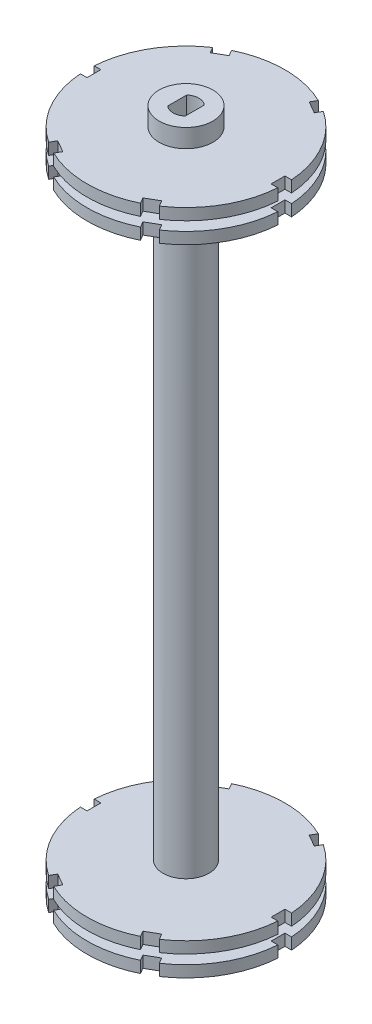
from build123d import *

# Parameters (mm, degrees)
BOSS_EXTRUDE1_DEPTH     = 6.5
SKETCH2_R               = 21.5
BOSS_EXTRUDE2_DEPTH     = 2.5
CUT_EXTRUDE1_DEPTH      = 8
SKETCH4_W               = 3
SKETCH4_H               = 3
CUT_EXTRUDE2_DEPTH      = 10
SKETCH5_R               = 5
BOSS_EXTRUDE3_DEPTH     = 140
CUT_EXTRUDE3_DEPTH      = 15
MIRROR6_COPY_1_SKETCH_R = 21.5
MIRROR6_COPY_1_DEPTH    = 2.5
MIRROR6_COPY_2_SKETCH_W = 3
MIRROR6_COPY_2_SKETCH_H = 3
MIRROR6_COPY_2_DEPTH    = 10


with BuildPart() as part:
    # Sketch1 → Boss-Extrude1 (new body)
    with BuildSketch(Plane(origin=(0, 0, 0), x_dir=(1, 0, 0), z_dir=(0, 1, 0))):
        with BuildLine():
            ThreePointArc((-1.9, -2.05669638), (-2.8, 0), (-1.9, 2.05669638))
            Line((-1.9, 2.05669638), (-1.9, 5.532856405))
            ThreePointArc((-1.9, 5.532856405), (-5.85, 0), (-1.9, -5.532856405))
            Line((-1.9, -5.532856405), (-1.9, -2.05669638))
        make_face()
        with BuildLine():
            ThreePointArc((-1.9, 2.05669638), (0, 2.8), (1.9, 2.05669638))
            Line((1.9, 2.05669638), (1.9, 5.532856405))
            ThreePointArc((1.9, 5.532856405), (0, 5.85), (-1.9, 5.532856405))
            Line((-1.9, 5.532856405), (-1.9, 2.05669638))
        make_face()
        with BuildLine():
            Line((1.9, 5.532856405), (1.9, 2.05669638))
            ThreePointArc((1.9, 2.05669638), (2.565151068, 1.122497216), (2.8, 0))
            ThreePointArc((2.8, 0), (2.565151068, -1.122497216), (1.9, -2.05669638))
            Line((1.9, -2.05669638), (1.9, -5.532856405))
            ThreePointArc((1.9, -5.532856405), (4.761171074, -3.399080758), (5.85, 0))
            ThreePointArc((5.85, 0), (4.761171074, 3.399080758), (1.9, 5.532856405))
        make_face()
        with BuildLine():
            Line((1.9, -5.532856405), (1.9, -2.05669638))
            ThreePointArc((1.9, -2.05669638), (0, -2.8), (-1.9, -2.05669638))
            Line((-1.9, -2.05669638), (-1.9, -5.532856405))
            ThreePointArc((-1.9, -5.532856405), (0, -5.85), (1.9, -5.532856405))
        make_face()
        with BuildLine():
            Line((-1.9, -2.05669638), (-1.9, 2.05669638))
            ThreePointArc((-1.9, 2.05669638), (-2.8, 0), (-1.9, -2.05669638))
        make_face()
        with BuildLine():
            ThreePointArc((2.8, 0), (2.565151068, 1.122497216), (1.9, 2.05669638))
            Line((1.9, 2.05669638), (1.9, -2.05669638))
            ThreePointArc((1.9, -2.05669638), (2.565151068, -1.122497216), (2.8, 0))
        make_face()
    boss_extrude1 = extrude(amount=BOSS_EXTRUDE1_DEPTH)

    # Sketch2 → Boss-Extrude2 (add)
    with BuildSketch(Plane(origin=(0, 6.5, 0), x_dir=(1, 0, 0), z_dir=(0, 1, 0))):
        with Locations(Location((0, 0, 0), (0, 0, 270))):
            Circle(SKETCH2_R)
    boss_extrude2 = extrude(amount=-BOSS_EXTRUDE2_DEPTH)

    # Sketch3 → Cut-Extrude1 (cut)
    with BuildSketch(Plane.XZ.offset(-4)):
        with BuildLine():
            Line((-1.9, 2.05669638), (-1.9, -2.05669638))
            ThreePointArc((-1.9, -2.05669638), (0, -2.8), (1.9, -2.05669638))
            Line((1.9, -2.05669638), (1.9, 2.05669638))
            ThreePointArc((1.9, 2.05669638), (0, 2.8), (-1.9, 2.05669638))
        make_face()
    cut_extrude1 = extrude(amount=-CUT_EXTRUDE1_DEPTH, mode=Mode.SUBTRACT)

    # Sketch4 → Cut-Extrude2 (cut)
    with BuildSketch(Plane(origin=(0, 6.5, 0), x_dir=(1, 0, 0), z_dir=(0, 1, 0))):
        Polygon((11.299038106, -16.570508076), (12.799038106, -19.168584287), (10.200961894, -20.668584287), (8.700961894, -18.070508076), align=None)
        with Locations((21.5, 0)):
            Rectangle(SKETCH4_W, SKETCH4_H)
        Polygon((-8.700961894, -18.070508076), (-10.200961894, -20.668584287), (-12.799038106, -19.168584287), (-11.299038106, -16.570508076), align=None)
        with Locations((-21.5, 0)):
            Rectangle(SKETCH4_W, SKETCH4_H)
        Polygon((-11.299038106, 16.570508076), (-12.799038106, 19.168584287), (-10.200961894, 20.668584287), (-8.700961894, 18.070508076), align=None)
        Polygon((8.700961894, 18.070508076), (10.200961894, 20.668584287), (12.799038106, 19.168584287), (11.299038106, 16.570508076), align=None)
    cut_extrude2 = extrude(amount=-CUT_EXTRUDE2_DEPTH, mode=Mode.SUBTRACT)

    # Sketch5 → Boss-Extrude3 (add)
    with BuildSketch(Plane(origin=(0, 6.5, 0), x_dir=(1, 0, 0), z_dir=(0, 1, 0))):
        with Locations(Location((0, 0, 0), (0, 0, 270))):
            Circle(SKETCH5_R)
    extrude(amount=BOSS_EXTRUDE3_DEPTH)

    # Mirror1: Boss-Extrude2 across plane
    add(boss_extrude2.mirror(Plane.ZX.offset(76.5)))

    # Mirror2: Boss-Extrude1 across plane
    add(boss_extrude1.mirror(Plane.ZX.offset(76.5)))

    # Mirror3: Boss-Extrude2, Cut-Extrude1, Cut-Extrude2 across plane
    add(boss_extrude2.mirror(Plane.ZX.offset(7.5)))
    add(cut_extrude1.mirror(Plane.ZX.offset(7.5)), mode=Mode.SUBTRACT)
    add(cut_extrude2.mirror(Plane.ZX.offset(7.5)), mode=Mode.SUBTRACT)

    # Sketch6 → Cut-Extrude3 (cut)
    with BuildSketch(Plane.XZ.offset(-11)):
        with BuildLine():
            Line((-1.9, 2.05669638), (-1.9, -2.05669638))
            ThreePointArc((-1.9, -2.05669638), (0, -2.8), (1.9, -2.05669638))
            Line((1.9, -2.05669638), (1.9, 2.05669638))
            ThreePointArc((1.9, 2.05669638), (0, 2.8), (-1.9, 2.05669638))
        make_face()
    extrude(amount=-CUT_EXTRUDE3_DEPTH, mode=Mode.SUBTRACT)

    # Mirror5: Cut-Extrude2 across plane
    add(cut_extrude2.mirror(Plane.ZX.offset(76.5)), mode=Mode.SUBTRACT)

    # Mirror6 copy 1 sketch → Mirror6 copy 1 (add)
    with BuildSketch(Plane(origin=(0, 144.5, 0), x_dir=(1, 0, 0), z_dir=(0, 1, 0))):
        with Locations(Location((0, 0, 0), (0, 0, 270))):
            Circle(MIRROR6_COPY_1_SKETCH_R)
    extrude(amount=-MIRROR6_COPY_1_DEPTH)

    # Mirror6 copy 2 sketch → Mirror6 copy 2 (cut)
    with BuildSketch(Plane(origin=(0, 144.5, 0), x_dir=(1, 0, 0), z_dir=(0, 1, 0))):
        Polygon((11.299038106, -16.570508076), (12.799038106, -19.168584287), (10.200961894, -20.668584287), (8.700961894, -18.070508076), align=None)
        with Locations((21.5, 0)):
            Rectangle(MIRROR6_COPY_2_SKETCH_W, MIRROR6_COPY_2_SKETCH_H)
        Polygon((-8.700961894, -18.070508076), (-10.200961894, -20.668584287), (-12.799038106, -19.168584287), (-11.299038106, -16.570508076), align=None)
        with Locations((-21.5, 0)):
            Rectangle(MIRROR6_COPY_2_SKETCH_W, MIRROR6_COPY_2_SKETCH_H)
        Polygon((-11.299038106, 16.570508076), (-12.799038106, 19.168584287), (-10.200961894, 20.668584287), (-8.700961894, 18.070508076), align=None)
        Polygon((8.700961894, 18.070508076), (10.200961894, 20.668584287), (12.799038106, 19.168584287), (11.299038106, 16.570508076), align=None)
    extrude(amount=-MIRROR6_COPY_2_DEPTH, mode=Mode.SUBTRACT)


solid = part.part
